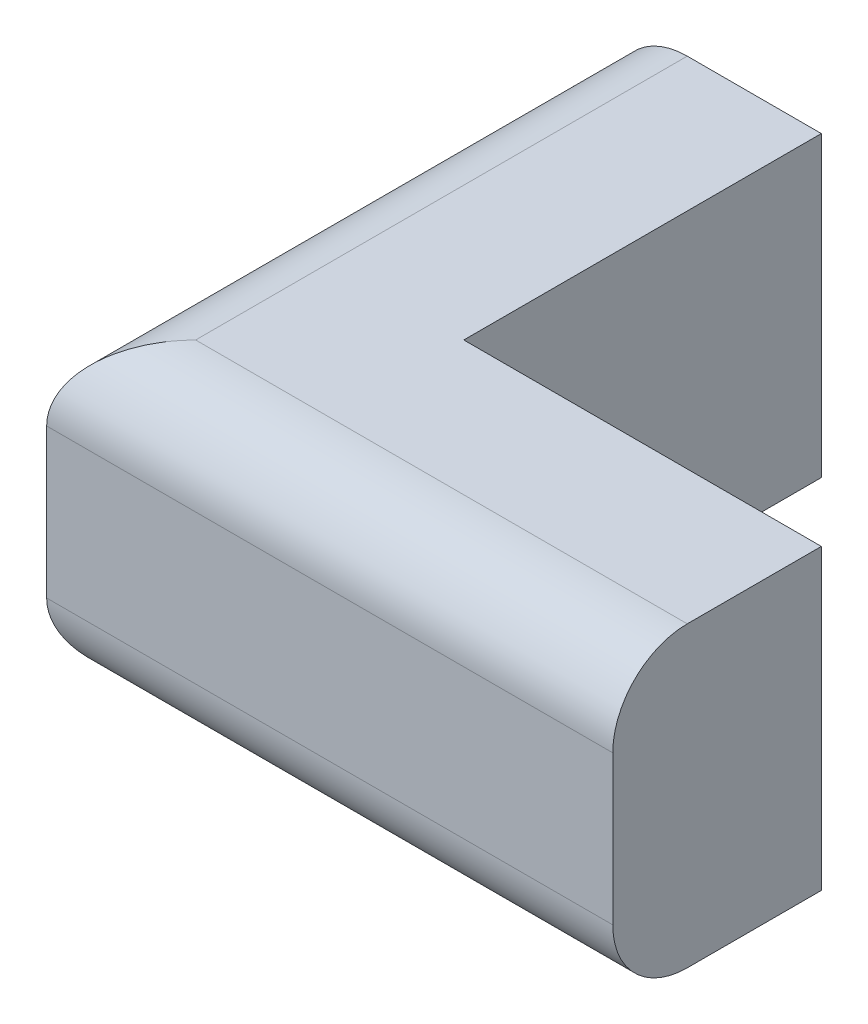
from build123d import *

# Parameters (mm, degrees)
BOSS_EXTRUDE1_DEPTH = 127
FILLET1_R           = 31.75


with BuildPart() as part:
    # Sketch1 → Boss-Extrude1 (new body)
    with BuildSketch(Plane(origin=(0, 0, 0), x_dir=(1, 0, 0), z_dir=(0, 1, 0))):
        Polygon((88.9, 88.9), (88.9, 241.3), (0, 241.3), (0, 0), (241.3, 0), (241.3, 88.9), align=None)
    extrude(amount=BOSS_EXTRUDE1_DEPTH)

    # Fillet1
    fillet1_edges = [part.edges().sort_by_distance(p)[0] for p in [
        (0, 127, -120.65),
        (120.65, 127, 0),
        (120.65, 0, 0),
        (0, 0, -120.65),
    ]]
    fillet(fillet1_edges, radius=FILLET1_R)


solid = part.part
